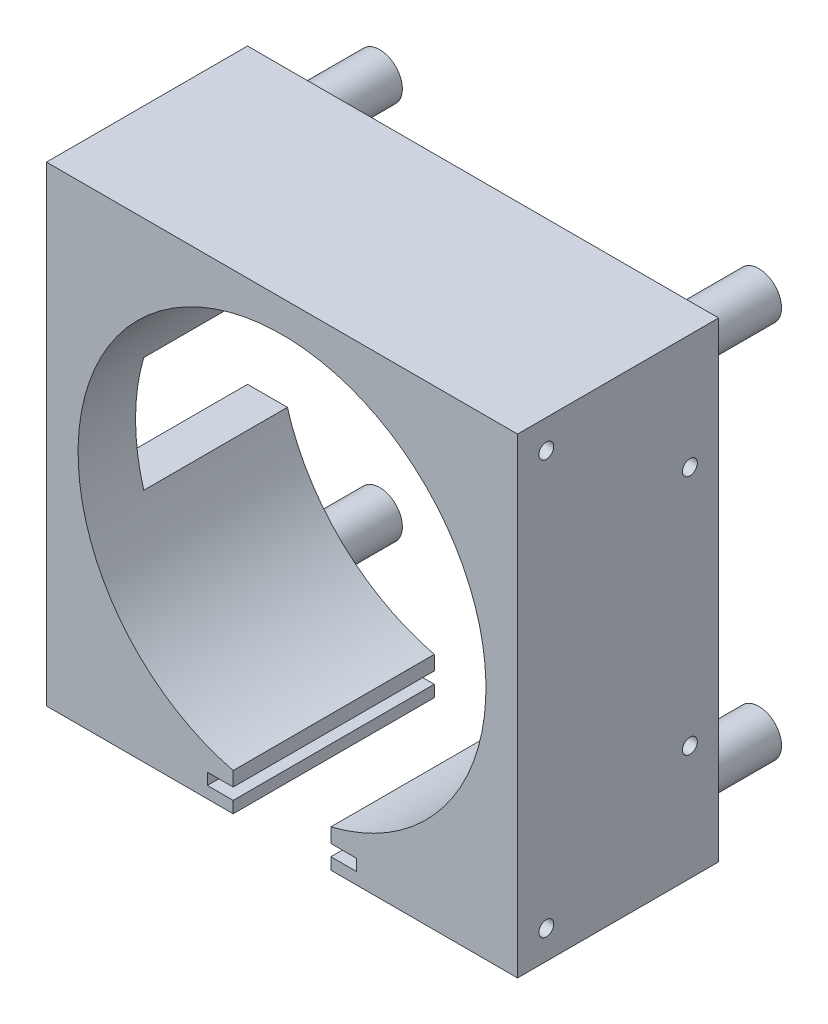
from build123d import *

# Parameters (mm, degrees)
SKETCH_1_W               = 82
SKETCH_1_H               = 82
SKETCH_1_R               = 35.5
EXTRUDE_1_DEPTH          = 35
CUT_EXTRUDE_1_REACH      = 79.727
CUT_EXTRUDE_START        = -10
SKETCH_2_W               = 8
SKETCH_2_H               = 20
SKETCH_3_R               = 3.95
EXTRUDE_2_DEPTH          = 15
PATTERN_CIRCULAR_1_COUNT = 4
SKETCH_4_R               = 1.3
CUT_EXTRUDE_2_DEPTH      = 9
MIRROR_4_COPY_1_SKETCH_R = 1.3
MIRROR_4_COPY_1_DEPTH    = 9
MIRROR_4_COPY_2_SKETCH_R = 1.3
MIRROR_4_COPY_2_DEPTH    = 9
CUT_EXTRUDE_3_DEPTH      = 77.56369897


with BuildPart() as part:
    # 草圖1 → 填料-伸長1 (new body)
    with BuildSketch(Plane.XY):
        Rectangle(SKETCH_1_W, SKETCH_1_H)
        Circle(SKETCH_1_R, mode=Mode.SUBTRACT)
    extrude(amount=EXTRUDE_1_DEPTH)

    # 草圖2 → 除料-伸長1 (cut, up to next)
    with BuildSketch(Plane.XY.offset(35).offset(CUT_EXTRUDE_START), mode=Mode.PRIVATE) as cut_extrude_1_sk1:
        with Locations((-37, 0)):
            Rectangle(SKETCH_2_W, SKETCH_2_H)
    cut_extrude_1_tool1 = extrude(cut_extrude_1_sk1.sketch, amount=-CUT_EXTRUDE_1_REACH, mode=Mode.PRIVATE) & part.part
    add(cut_extrude_1_tool1.solids().sort_by_distance((-37, 0, 25))[0], mode=Mode.SUBTRACT)

    # 草圖3 → 填料-伸長2 (add)
    with BuildSketch(Plane(origin=(0, 0, 0), x_dir=(-1, 0, 0), z_dir=(0, 0, -1))):
        with Locations((33, 33)):
            Circle(SKETCH_3_R)
    extrude_2 = extrude(amount=EXTRUDE_2_DEPTH)

    # 環狀複製排列1: 填料-伸長2 ×4 about axis
    pattern_circular_1_axis = Axis((0, 0, 55), (0, 0, -1))
    for i in range(1, PATTERN_CIRCULAR_1_COUNT):
        add(extrude_2.rotate(pattern_circular_1_axis, i * 360 / PATTERN_CIRCULAR_1_COUNT))

    # 草圖4 → 除料-伸長2 (cut)
    with BuildSketch(Plane.ZY.offset(41)):
        with Locations((5, -21)):
            Circle(SKETCH_4_R)
        with Locations((30, -36)):
            Circle(SKETCH_4_R)
    cut_extrude_2 = extrude(amount=-CUT_EXTRUDE_2_DEPTH, mode=Mode.SUBTRACT)

    # 鏡射2: 除料-伸長2 across plane
    add(cut_extrude_2.mirror(Plane.ZX), mode=Mode.SUBTRACT)

    # 鏡射4 copy 1 sketch → 鏡射4 copy 1 (cut)
    with BuildSketch(Plane(origin=(41, 0, 0), x_dir=(0, 0, 1), z_dir=(1, 0, 0))):
        with Locations((5, -21)):
            Circle(MIRROR_4_COPY_1_SKETCH_R)
        with Locations((30, -36)):
            Circle(MIRROR_4_COPY_1_SKETCH_R)
    extrude(amount=-MIRROR_4_COPY_1_DEPTH, mode=Mode.SUBTRACT)

    # 鏡射4 copy 2 sketch → 鏡射4 copy 2 (cut)
    with BuildSketch(Plane(origin=(41, 0, 0), x_dir=(0, 0, 1), z_dir=(1, 0, 0))):
        with Locations((5, 21)):
            Circle(MIRROR_4_COPY_2_SKETCH_R)
        with Locations((30, 36)):
            Circle(MIRROR_4_COPY_2_SKETCH_R)
    extrude(amount=-MIRROR_4_COPY_2_DEPTH, mode=Mode.SUBTRACT)

    # 草圖5 → 除料-伸長3 (cut, through all)
    with BuildSketch(Plane.XY.offset(35)):
        Polygon((-8.5, -36.967375879), (-8.5, -34.467375879), (8.5, -34.467375879), (8.5, -36.967375879), (13, -36.967375879), (13, -38.967375879), (8.5, -38.967375879), (8.5, -41.467375879), (-8.5, -41.467375879), (-8.5, -38.967375879), (-13, -38.967375879), (-13, -36.967375879), align=None)
    extrude(amount=-CUT_EXTRUDE_3_DEPTH, mode=Mode.SUBTRACT)


solid = part.part
